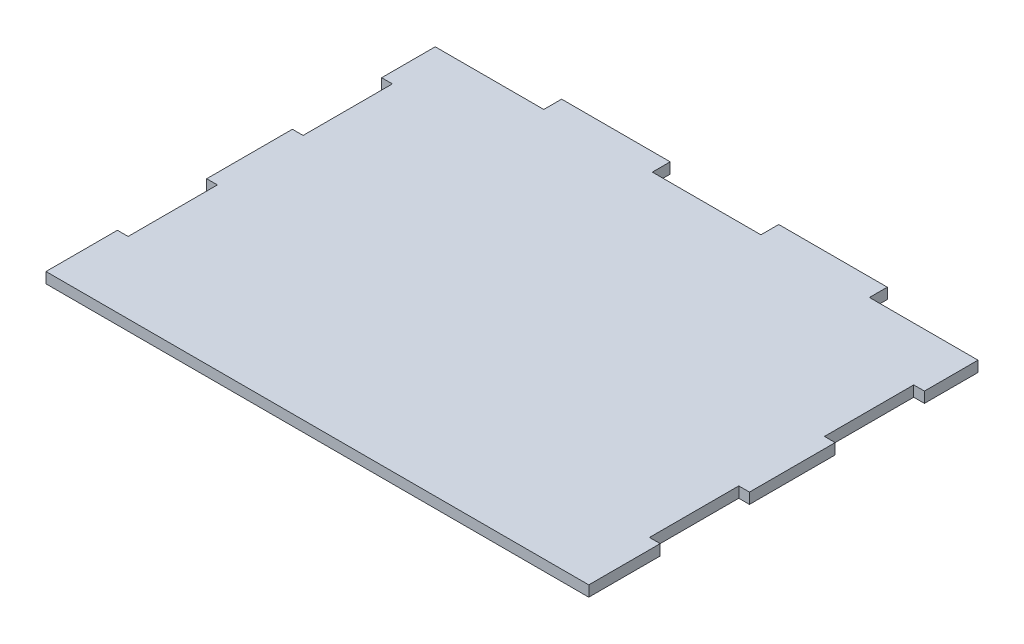
from build123d import *

# Parameters (mm, degrees)
BOSS_EXTRUDE1_DEPTH = 3


with BuildPart() as part:
    # Sketch1 → Boss-Extrude1 (new body)
    with BuildSketch(Plane(origin=(0, 0, 0), x_dir=(1, 0, 0), z_dir=(0, 1, 0))):
        Polygon((0, 52), (0, -57), (-76, -57), (-76, -37), (-73, -37), (-73, -12), (-76, -12), (-76, 12), (-73, 12), (-73, 37), (-76, 37), (-76, 52), (-45.6, 52), (-45.6, 57), (-15.2, 57), (-15.2, 52), align=None)
    boss_extrude1 = extrude(amount=BOSS_EXTRUDE1_DEPTH)

    # Mirror1: Boss-Extrude1 across plane
    add(boss_extrude1.mirror(Plane(origin=(0, 3, -52), x_dir=(0, 0, 1), z_dir=(-1, 0, 0))))


solid = part.part
